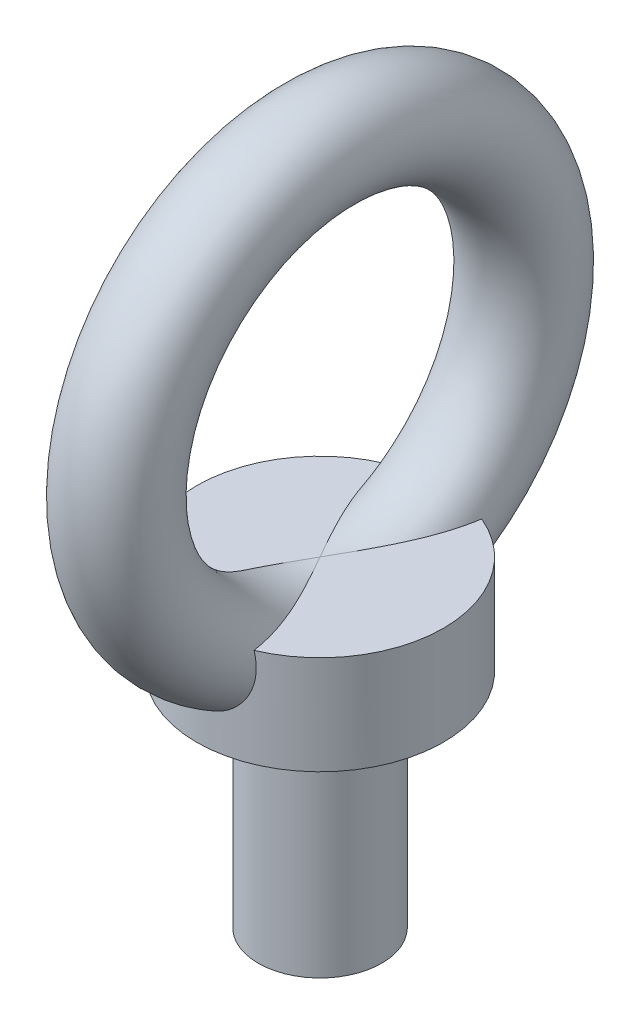
from build123d import *

# Parameters (mm, degrees)
SKETCH_1_R      = 5
EXTRUDE_1_DEPTH = 18
SKETCH_2_R      = 10
EXTRUDE_2_DEPTH = 8
SKETCH_3D_1_R   = 4


with BuildPart() as part:
    # 草圖1 → 填料-伸長1 (new body)
    with BuildSketch(Plane(origin=(0, 0, 0), x_dir=(1, 0, 0), z_dir=(0, 1, 0))):
        with Locations(Location((0, 0, 0), (0, 0, 270))):
            Circle(SKETCH_1_R)
    extrude(amount=EXTRUDE_1_DEPTH)

    # 草圖2 → 填料-伸長2 (add)
    with BuildSketch(Plane(origin=(0, 18, 0), x_dir=(1, 0, 0), z_dir=(0, 1, 0))):
        with Locations(Location((0, 0, 0), (0, 0, 270))):
            Circle(SKETCH_2_R)
    extrude(amount=EXTRUDE_2_DEPTH)

    # Sketch 3D_1 → 旋轉1 (revolve)
    with BuildSketch(Plane(origin=(0, 0, 0), x_dir=(-0.14242880634815436, 0.98980504904867, 0), z_dir=(0, 0, -1)), mode=Mode.PRIVATE) as revolve_1_sk:
        with Locations((21.775711079, 3.13343374)):
            Circle(SKETCH_3D_1_R)
    revolve(revolve_1_sk.sketch.rotate(Axis((0, 38.5, 0), (-1, 0, 0)), 180), axis=Axis((0, 38.5, 0), (-1, 0, 0)))


solid = part.part
